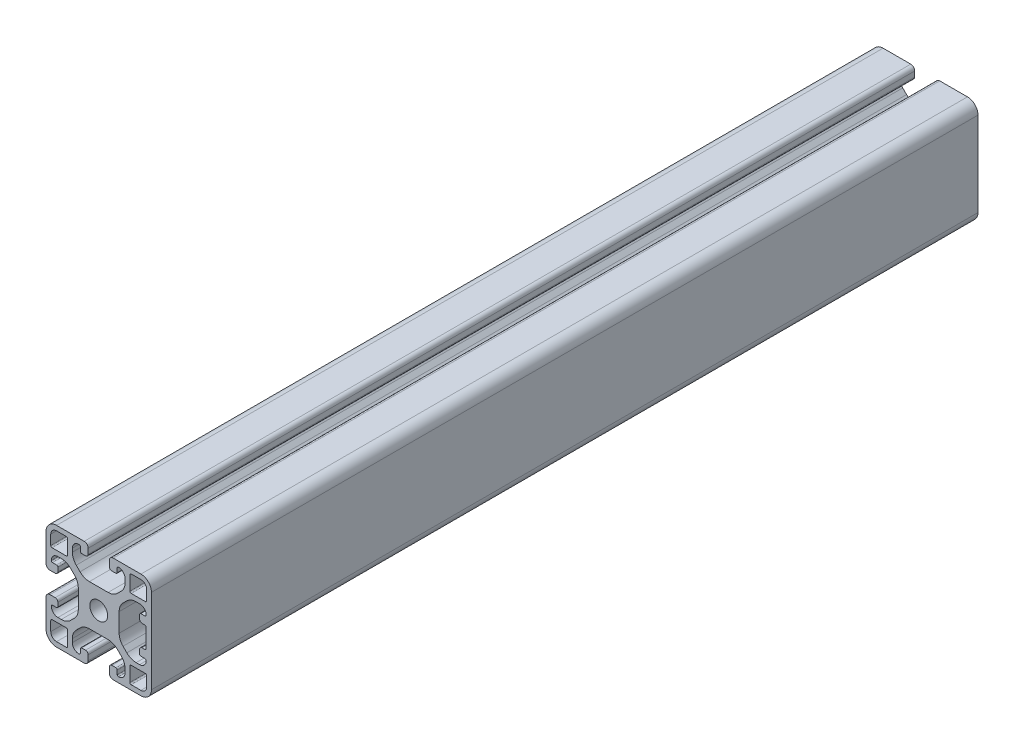
from build123d import *

# Parameters (mm, degrees)
SCHIZZO1_R                   = 3.4
ESTRUSIONE_ESTRUSIONE1_DEPTH = 313.48


with BuildPart() as part:
    # Schizzo1 → Estrusione-Estrusione1 (new body)
    with BuildSketch(Plane(origin=(0, 0, -340), x_dir=(-1, 0, 0), z_dir=(0, 0, -1))):
        with BuildLine():
            Line((6.5, -15.5), (5, -15.5))
            ThreePointArc((5, -15.5), (4.292893219, -15.792893219), (4, -16.5))
            Line((4, -16.5), (4, -18.5))
            ThreePointArc((4, -18.5), (4.439339828, -19.560660172), (5.5, -20))
            Line((5.5, -20), (16, -20))
            ThreePointArc((16, -20), (18.828427125, -18.828427125), (20, -16))
            Line((20, -16), (20, -5.5))
            ThreePointArc((20, -5.5), (19.560660172, -4.439339828), (18.5, -4))
            Line((18.5, -4), (16.5, -4))
            ThreePointArc((16.5, -4), (15.792893219, -4.292893219), (15.5, -5))
            Line((15.5, -5), (15.5, -6.5))
            ThreePointArc((15.5, -6.5), (15.646446609, -6.853553391), (16, -7))
            Line((16, -7), (17.55, -7))
            ThreePointArc((17.55, -7), (17.868198052, -7.131801948), (18, -7.45))
            Line((18, -7.45), (18, -7.5))
            ThreePointArc((18, -7.5), (17.267766953, -9.267766953), (15.5, -10))
            Line((15.5, -10), (14.192388155, -10))
            ThreePointArc((14.192388155, -10), (12.278970994, -9.619397663), (10.656854249, -8.535533906))
            Line((10.656854249, -8.535533906), (9.214466094, -7.09314575))
            ThreePointArc((9.214466094, -7.09314575), (8.130602337, -5.471029006), (7.75, -3.557611845))
            Line((7.75, -3.557611845), (7.75, 3.557611845))
            ThreePointArc((7.75, 3.557611845), (8.130602337, 5.471029006), (9.214466094, 7.09314575))
            Line((9.214466094, 7.09314575), (10.656854249, 8.535533906))
            ThreePointArc((10.656854249, 8.535533906), (12.278970994, 9.619397663), (14.192388155, 10))
            Line((14.192388155, 10), (15.5, 10))
            ThreePointArc((15.5, 10), (17.267766953, 9.267766953), (18, 7.5))
            Line((18, 7.5), (18, 7.45))
            ThreePointArc((18, 7.45), (17.868198052, 7.131801948), (17.55, 7))
            Line((17.55, 7), (16, 7))
            ThreePointArc((16, 7), (15.646446609, 6.853553391), (15.5, 6.5))
            Line((15.5, 6.5), (15.5, 5))
            ThreePointArc((15.5, 5), (15.792893219, 4.292893219), (16.5, 4))
            Line((16.5, 4), (18.5, 4))
            ThreePointArc((18.5, 4), (19.560660172, 4.439339828), (20, 5.5))
            Line((20, 5.5), (20, 16))
            ThreePointArc((20, 16), (18.828427125, 18.828427125), (16, 20))
            Line((16, 20), (5.5, 20))
            ThreePointArc((5.5, 20), (4.439339828, 19.560660172), (4, 18.5))
            Line((4, 18.5), (4, 16.5))
            ThreePointArc((4, 16.5), (4.292893219, 15.792893219), (5, 15.5))
            Line((5, 15.5), (6.5, 15.5))
            ThreePointArc((6.5, 15.5), (6.853553391, 15.646446609), (7, 16))
            Line((7, 16), (7, 17.55))
            ThreePointArc((7, 17.55), (7.131801948, 17.868198052), (7.45, 18))
            Line((7.45, 18), (7.5, 18))
            ThreePointArc((7.5, 18), (9.267766953, 17.267766953), (10, 15.5))
            Line((10, 15.5), (10, 14.192388155))
            ThreePointArc((10, 14.192388155), (9.619397663, 12.278970994), (8.535533906, 10.656854249))
            Line((8.535533906, 10.656854249), (7.09314575, 9.214466094))
            ThreePointArc((7.09314575, 9.214466094), (5.471029006, 8.130602337), (3.557611844, 7.75))
            Line((3.557611844, 7.75), (-3.557611845, 7.75))
            ThreePointArc((-3.557611845, 7.75), (-5.471029006, 8.130602337), (-7.09314575, 9.214466094))
            Line((-7.09314575, 9.214466094), (-8.535533906, 10.656854249))
            ThreePointArc((-8.535533906, 10.656854249), (-9.619397663, 12.278970994), (-10, 14.192388155))
            Line((-10, 14.192388155), (-10, 15.5))
            ThreePointArc((-10, 15.5), (-9.267766953, 17.267766953), (-7.5, 18))
            Line((-7.5, 18), (-7.45, 18))
            ThreePointArc((-7.45, 18), (-7.131801948, 17.868198052), (-7, 17.55))
            Line((-7, 17.55), (-7, 16))
            ThreePointArc((-7, 16), (-6.853553391, 15.646446609), (-6.5, 15.5))
            Line((-6.5, 15.5), (-5, 15.5))
            ThreePointArc((-5, 15.5), (-4.292893219, 15.792893219), (-4, 16.5))
            Line((-4, 16.5), (-4, 18.5))
            ThreePointArc((-4, 18.5), (-4.439339828, 19.560660172), (-5.5, 20))
            Line((-5.5, 20), (-16, 20))
            ThreePointArc((-16, 20), (-18.828427125, 18.828427125), (-20, 16))
            Line((-20, 16), (-20, -16))
            ThreePointArc((-20, -16), (-18.828427125, -18.828427125), (-16, -20))
            Line((-16, -20), (-5.5, -20))
            ThreePointArc((-5.5, -20), (-4.439339828, -19.560660172), (-4, -18.5))
            Line((-4, -18.5), (-4, -16.5))
            ThreePointArc((-4, -16.5), (-4.292893219, -15.792893219), (-5, -15.5))
            Line((-5, -15.5), (-6.5, -15.5))
            ThreePointArc((-6.5, -15.5), (-6.853553391, -15.646446609), (-7, -16))
            Line((-7, -16), (-7, -17.55))
            ThreePointArc((-7, -17.55), (-7.131801948, -17.868198052), (-7.45, -18))
            Line((-7.45, -18), (-7.5, -18))
            ThreePointArc((-7.5, -18), (-9.267766953, -17.267766953), (-10, -15.5))
            Line((-10, -15.5), (-10, -14.192388155))
            ThreePointArc((-10, -14.192388155), (-9.619397663, -12.278970994), (-8.535533906, -10.656854249))
            Line((-8.535533906, -10.656854249), (-7.09314575, -9.214466094))
            ThreePointArc((-7.09314575, -9.214466094), (-5.471029006, -8.130602337), (-3.557611845, -7.75))
            Line((-3.557611845, -7.75), (3.557611845, -7.75))
            ThreePointArc((3.557611845, -7.75), (5.471029006, -8.130602337), (7.09314575, -9.214466094))
            Line((7.09314575, -9.214466094), (8.535533906, -10.656854249))
            ThreePointArc((8.535533906, -10.656854249), (9.619397663, -12.278970994), (10, -14.192388155))
            Line((10, -14.192388155), (10, -15.5))
            ThreePointArc((10, -15.5), (9.267766953, -17.267766953), (7.5, -18))
            Line((7.5, -18), (7.45, -18))
            ThreePointArc((7.45, -18), (7.131801948, -17.868198052), (7, -17.55))
            Line((7, -17.55), (7, -16))
            ThreePointArc((7, -16), (6.853553391, -15.646446609), (6.5, -15.5))
        make_face()
        with Locations(Location((0, 0, 0), (0, 0, 180))):
            Circle(SCHIZZO1_R, mode=Mode.SUBTRACT)
        with BuildLine():
            Line((-12.3, -18.2), (-16, -18.2))
            ThreePointArc((-16, -18.2), (-17.555634919, -17.555634919), (-18.2, -16))
            Line((-18.2, -16), (-18.2, -12.3))
            ThreePointArc((-18.2, -12.3), (-18.053553391, -11.946446609), (-17.7, -11.8))
            Line((-17.7, -11.8), (-12.3, -11.8))
            ThreePointArc((-12.3, -11.8), (-11.946446609, -11.946446609), (-11.8, -12.3))
            Line((-11.8, -12.3), (-11.8, -17.7))
            ThreePointArc((-11.8, -17.7), (-11.946446609, -18.053553391), (-12.3, -18.2))
        make_face(mode=Mode.SUBTRACT)
        with BuildLine():
            Line((-11.8, 17.7), (-11.8, 12.3))
            ThreePointArc((-11.8, 12.3), (-11.946446609, 11.946446609), (-12.3, 11.8))
            Line((-12.3, 11.8), (-17.7, 11.8))
            ThreePointArc((-17.7, 11.8), (-18.053553391, 11.946446609), (-18.2, 12.3))
            Line((-18.2, 12.3), (-18.2, 16))
            ThreePointArc((-18.2, 16), (-17.555634919, 17.555634919), (-16, 18.2))
            Line((-16, 18.2), (-12.3, 18.2))
            ThreePointArc((-12.3, 18.2), (-11.946446609, 18.053553391), (-11.8, 17.7))
        make_face(mode=Mode.SUBTRACT)
        with BuildLine():
            Line((18.2, 16), (18.2, 12.3))
            ThreePointArc((18.2, 12.3), (18.053553391, 11.946446609), (17.7, 11.8))
            Line((17.7, 11.8), (12.3, 11.8))
            ThreePointArc((12.3, 11.8), (11.946446609, 11.946446609), (11.8, 12.3))
            Line((11.8, 12.3), (11.8, 17.7))
            ThreePointArc((11.8, 17.7), (11.946446609, 18.053553391), (12.3, 18.2))
            Line((12.3, 18.2), (16, 18.2))
            ThreePointArc((16, 18.2), (17.555634919, 17.555634919), (18.2, 16))
        make_face(mode=Mode.SUBTRACT)
        with BuildLine():
            Line((18.2, -12.3), (18.2, -16))
            ThreePointArc((18.2, -16), (17.555634919, -17.555634919), (16, -18.2))
            Line((16, -18.2), (12.3, -18.2))
            ThreePointArc((12.3, -18.2), (11.946446609, -18.053553391), (11.8, -17.7))
            Line((11.8, -17.7), (11.8, -12.3))
            ThreePointArc((11.8, -12.3), (11.946446609, -11.946446609), (12.3, -11.8))
            Line((12.3, -11.8), (17.7, -11.8))
            ThreePointArc((17.7, -11.8), (18.053553391, -11.946446609), (18.2, -12.3))
        make_face(mode=Mode.SUBTRACT)
        with BuildLine():
            Line((-16, 7), (-17.5, 7))
            ThreePointArc((-17.5, 7), (-17.853553391, 7.146446609), (-18, 7.5))
            ThreePointArc((-18, 7.5), (-17.267766953, 9.267766953), (-15.5, 10))
            Line((-15.5, 10), (-14.192388155, 10))
            ThreePointArc((-14.192388155, 10), (-12.278970994, 9.619397663), (-10.656854249, 8.535533906))
            Line((-10.656854249, 8.535533906), (-9.214466094, 7.093145751))
            ThreePointArc((-9.214466094, 7.093145751), (-8.130602337, 5.471029006), (-7.75, 3.557611845))
            Line((-7.75, 3.557611845), (-7.75, -3.557611845))
            ThreePointArc((-7.75, -3.557611845), (-8.130602337, -5.471029006), (-9.214466094, -7.093145751))
            Line((-9.214466094, -7.093145751), (-10.656854249, -8.535533906))
            ThreePointArc((-10.656854249, -8.535533906), (-12.278970994, -9.619397663), (-14.192388155, -10))
            Line((-14.192388155, -10), (-15.5, -10))
            ThreePointArc((-15.5, -10), (-17.267766953, -9.267766953), (-18, -7.5))
            ThreePointArc((-18, -7.5), (-17.853553391, -7.146446609), (-17.5, -7))
            Line((-17.5, -7), (-16, -7))
            ThreePointArc((-16, -7), (-15.646446609, -6.853553391), (-15.5, -6.5))
            Line((-15.5, -6.5), (-15.5, -5))
            ThreePointArc((-15.5, -5), (-15.792893219, -4.292893219), (-16.5, -4))
            Line((-16.5, -4), (-17.5, -4))
            ThreePointArc((-17.5, -4), (-17.853553391, -3.853553391), (-18, -3.5))
            Line((-18, -3.5), (-18, 3.5))
            ThreePointArc((-18, 3.5), (-17.853553391, 3.853553391), (-17.5, 4))
            Line((-17.5, 4), (-16.5, 4))
            ThreePointArc((-16.5, 4), (-15.792893219, 4.292893219), (-15.5, 5))
            Line((-15.5, 5), (-15.5, 6.5))
            ThreePointArc((-15.5, 6.5), (-15.646446609, 6.853553391), (-16, 7))
        make_face(mode=Mode.SUBTRACT)
    extrude(amount=-ESTRUSIONE_ESTRUSIONE1_DEPTH)


solid = part.part
